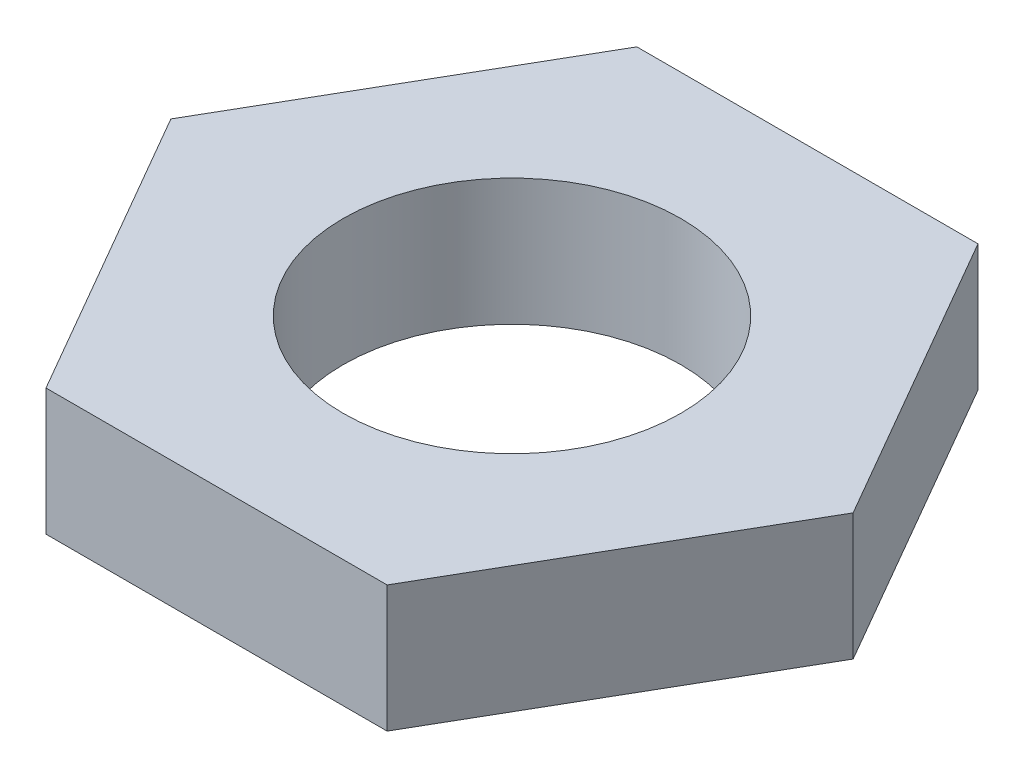
from build123d import *

# Parameters (mm, degrees)
SKETCH1_R           = 20
BOSS_EXTRUDE1_DEPTH = 15


with BuildPart() as part:
    # Sketch1 → Boss-Extrude1 (new body)
    with BuildSketch(Plane(origin=(0, 0, 0), x_dir=(1, 0, 0), z_dir=(0, 1, 0))):
        Polygon((-20.207259422, 35), (-40.414518843, 0), (-20.207259422, -35), (20.207259422, -35), (40.414518843, 0), (20.207259422, 35), align=None)
        with Locations(Location((0, 0, 0), (0, 0, 270))):
            Circle(SKETCH1_R, mode=Mode.SUBTRACT)
    extrude(amount=BOSS_EXTRUDE1_DEPTH)


solid = part.part
